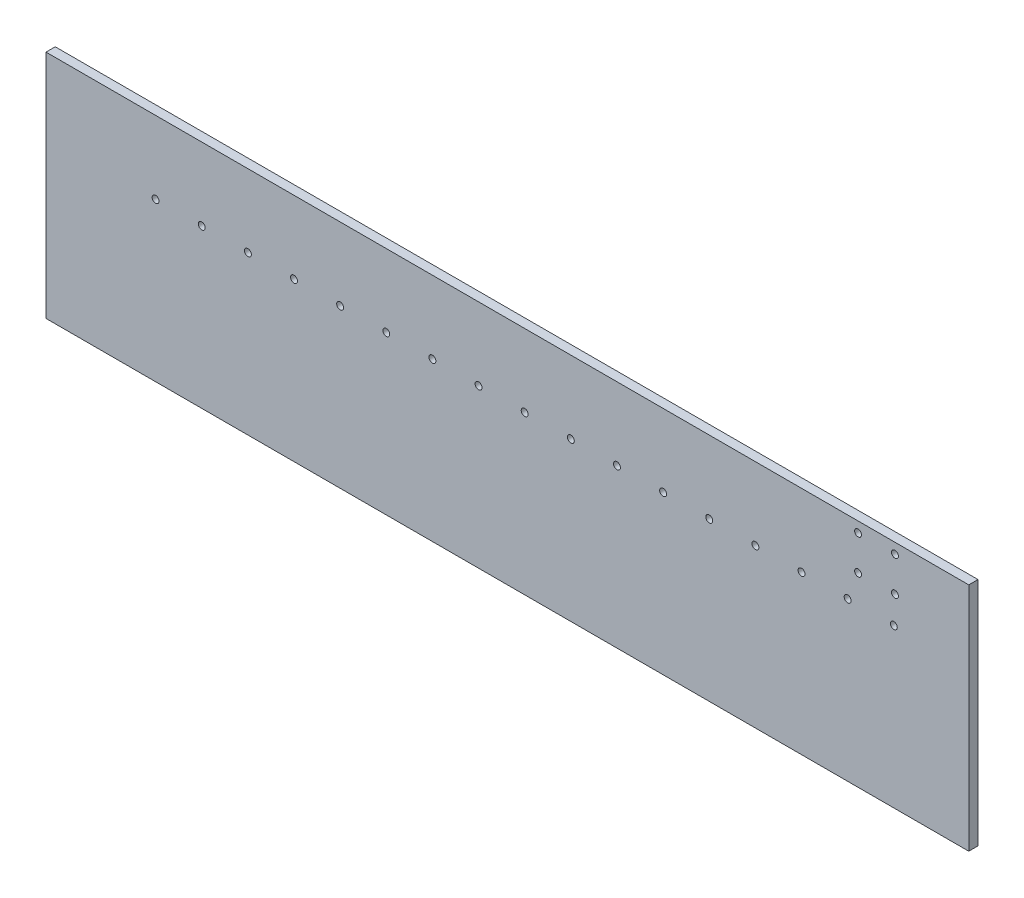
from build123d import *

# Parameters (mm, degrees)
SKETCH_1_W             = 400
SKETCH_1_H             = 100
EXTRUDE_1_DEPTH        = 4
SKETCH_2_R             = 1.5
CUT_EXTRUDE_1_DEPTH    = 4
SKETCH_3_R             = 1.5
CUT_EXTRUDE_2_DEPTH    = 4
PATTERN_LINEAR_1_COUNT = 17
PATTERN_LINEAR_1_PITCH = 20


with BuildPart() as part:
    # 草图1 → 凸台-拉伸1 (new body)
    with BuildSketch(Plane.XY):
        with Locations((200, 50)):
            Rectangle(SKETCH_1_W, SKETCH_1_H)
    extrude(amount=EXTRUDE_1_DEPTH)

    # 草图2 → 切除-拉伸1 (cut)
    with BuildSketch(Plane(origin=(0, 0, 0), x_dir=(-1, 0, 0), z_dir=(0, 0, -1))):
        with Locations((-368, 95.5)):
            Circle(SKETCH_2_R)
        with Locations((-352, 95.5)):
            Circle(SKETCH_2_R)
        with Locations((-368, 80.5)):
            Circle(SKETCH_2_R)
        with Locations((-352, 80.5)):
            Circle(SKETCH_2_R)
    extrude(amount=-CUT_EXTRUDE_1_DEPTH, mode=Mode.SUBTRACT)

    # 草图3 → 切除-拉伸2 (cut)
    with BuildSketch(Plane(origin=(0, 0, 0), x_dir=(-1, 0, 0), z_dir=(0, 0, -1))):
        with Locations((-367.5, 68.5)):
            Circle(SKETCH_3_R)
    cut_extrude_2 = extrude(amount=-CUT_EXTRUDE_2_DEPTH, mode=Mode.SUBTRACT)

    # 阵列(线性)1: 切除-拉伸2 ×17
    with Locations(*[(-i * PATTERN_LINEAR_1_PITCH, 0, 0) for i in range(1, PATTERN_LINEAR_1_COUNT)]):
        add(cut_extrude_2, mode=Mode.SUBTRACT)


solid = part.part
